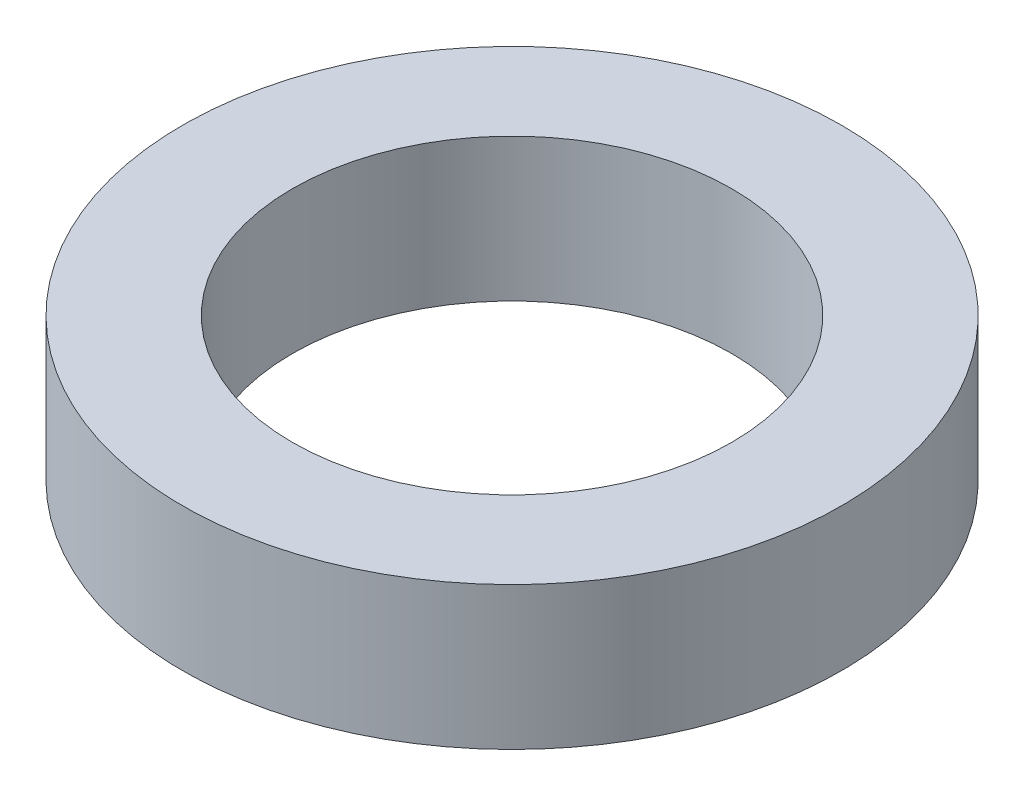
from build123d import *

# Parameters (mm, degrees)
SKETCH_1_R      = 30
SKETCH_1_R_2    = 20
EXTRUDE_1_DEPTH = 13


with BuildPart() as part:
    # 草图1 → 凸台-拉伸1 (new body)
    with BuildSketch(Plane(origin=(0, 0, 0), x_dir=(1, 0, 0), z_dir=(0, 1, 0))):
        with Locations(Location((0, 0, 0), (0, 0, 90))):
            Circle(SKETCH_1_R)
        with Locations(Location((0, 0, 0), (0, 0, 90))):
            Circle(SKETCH_1_R_2, mode=Mode.SUBTRACT)
    extrude(amount=EXTRUDE_1_DEPTH)


solid = part.part
